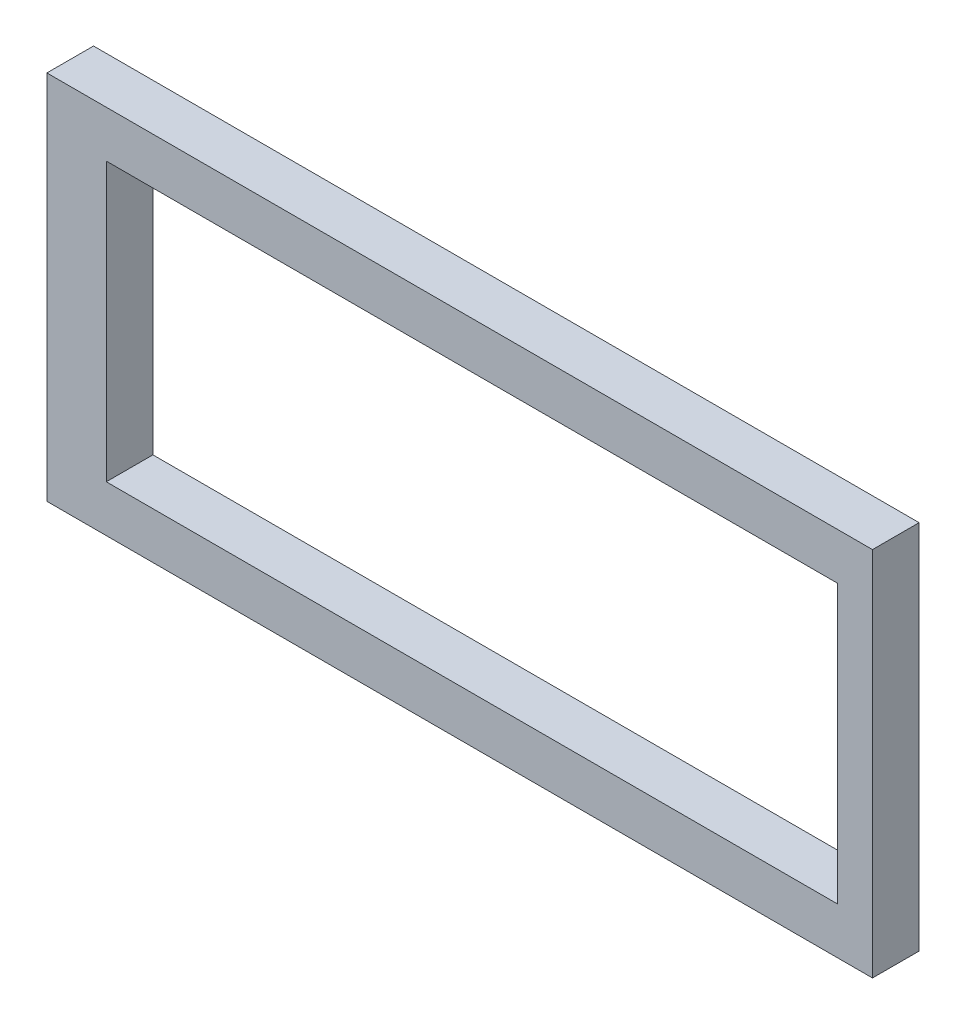
from build123d import *

# Parameters (mm, degrees)
SKETCH2_W           = 88.520215402
SKETCH2_H           = 39.780418306
SKETCH2_W_2         = 78.37990372
SKETCH2_H_2         = 29.780418306
BOSS_EXTRUDE1_DEPTH = 5


with BuildPart() as part:
    # Sketch2 → Boss-Extrude1 (new body)
    with BuildSketch(Plane.XY):
        with Locations((95.128964829, 0)):
            Rectangle(SKETCH2_W, SKETCH2_H)
        with Locations((96.427494729, 0)):
            Rectangle(SKETCH2_W_2, SKETCH2_H_2, mode=Mode.SUBTRACT)
    extrude(amount=BOSS_EXTRUDE1_DEPTH)


solid = part.part
